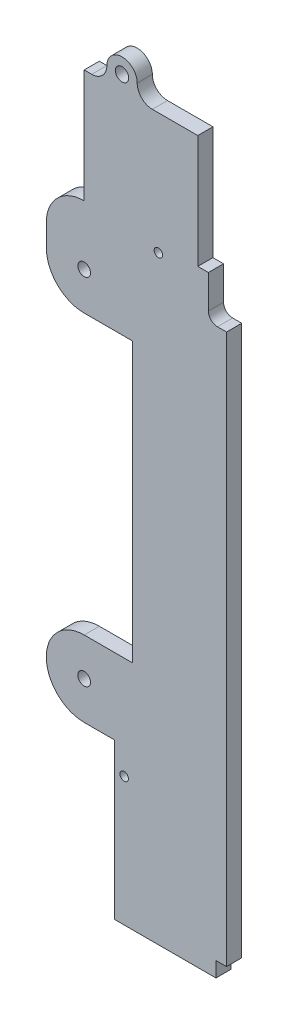
from build123d import *

# Parameters (mm, degrees)
SKETCH1_R           = 2.1
SKETCH1_R_2         = 2.2
BOSS_EXTRUDE1_DEPTH = 5
SKETCH2_R           = 1.4
CUT_EXTRUDE1_DEPTH  = 190.973682388


with BuildPart() as part:
    # Sketch1 → Boss-Extrude1 (new body)
    with BuildSketch(Plane.XY):
        with BuildLine():
            Line((41, 136.6), (41, 125.6))
            ThreePointArc((41, 125.6), (41.878679656, 123.478679656), (44, 122.6))
            Line((44, 122.6), (47, 122.6))
            Line((47, 122.6), (47, -29.8))
            Line((47, -29.8), (47, -58.8))
            Line((47, -58.8), (43.5, -58.8))
            Line((43.5, -58.8), (43.5, -63.8))
            Line((43.5, -63.8), (10, -63.8))
            Line((10, -63.8), (10, -29.8))
            Line((10, -29.8), (10, -12.5))
            Line((10, -12.5), (0, -12.5))
            ThreePointArc((0, -12.5), (-12.5, 0), (0, 12.5))
            Line((0, 12.5), (16, 12.5))
            Line((16, 12.5), (16, 104.5))
            Line((16, 104.5), (0, 104.5))
            ThreePointArc((0, 104.5), (-8.838834765, 108.161165235), (-12.5, 117))
            Line((-12.5, 117), (-12.5, 124.1))
            ThreePointArc((-12.5, 124.1), (-8.838834765, 132.938834765), (0, 136.6))
            Line((0, 136.6), (0, 174))
            Line((0, 174), (2.5, 174))
            ThreePointArc((2.5, 174), (6.035533906, 175.464466094), (7.5, 179))
            ThreePointArc((7.5, 179), (12.5, 184), (17.5, 179))
            ThreePointArc((17.5, 179), (18.964466094, 175.464466094), (22.5, 174))
            Line((22.5, 174), (37.5, 174))
            Line((37.5, 174), (37.5, 136.6))
            Line((37.5, 136.6), (41, 136.6))
        make_face()
        Circle(SKETCH1_R, mode=Mode.SUBTRACT)
        with Locations((0, 117)):
            Circle(SKETCH1_R, mode=Mode.SUBTRACT)
        with Locations((12.5, 179)):
            Circle(SKETCH1_R_2, mode=Mode.SUBTRACT)
    extrude(amount=BOSS_EXTRUDE1_DEPTH)

    # Sketch2 → Cut-Extrude1 (cut, through all)
    with BuildSketch(Plane.XY.offset(5)):
        with Locations((13.2, -21.3)):
            Circle(SKETCH2_R)
        with Locations((24.5, 134)):
            Circle(SKETCH2_R)
    extrude(amount=-CUT_EXTRUDE1_DEPTH, mode=Mode.SUBTRACT)


solid = part.part
